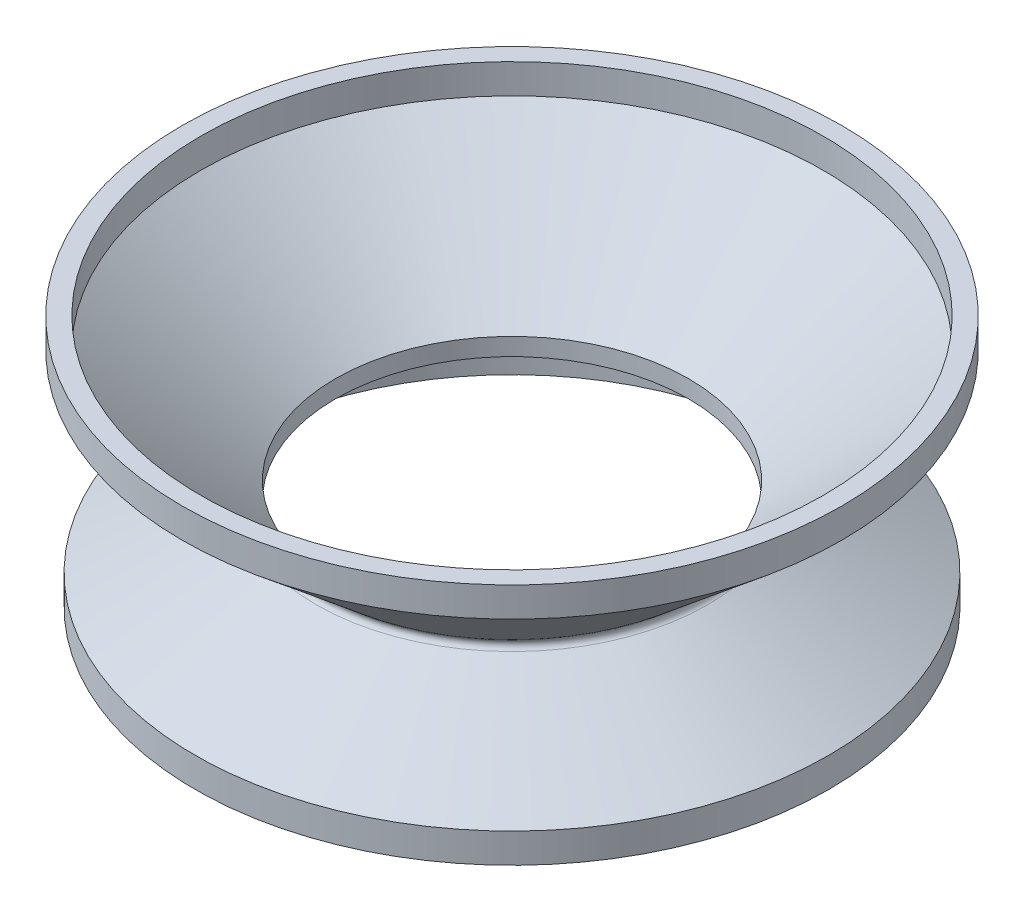
from build123d import *

# Parameters (mm, degrees)
FILLET2_R           = 0.4
SKETCH2_R           = 22.244579061
SKETCH2_R_2         = 21
BOSS_EXTRUDE1_DEPTH = 2
SKETCH3_R           = 21.370804359
SKETCH3_R_2         = 19.170804359
BOSS_EXTRUDE2_DEPTH = 2


with BuildPart() as part:
    # Sketch1 → Revolve1 (revolve)
    with BuildSketch(Plane.XY):
        Polygon((0.662781953, 0), (-8.871246788, 8), (-7.626667727, 8), (1.462781953, 0.373046127), (1.462781953, -0.808290377), (-5.797472085, -5), (-7.997472085, -5), align=None)
    revolve(axis=Axis((13.373332273, 7.609018033, 0), (0, -1, 0)))

    # Fillet2
    fillet2_edges = [part.edges().sort_by_distance(p)[0] for p in [
        (26.083882594, 0, 0),
    ]]
    fillet(fillet2_edges, radius=FILLET2_R)

    # Sketch2 → Boss-Extrude1 (add)
    with BuildSketch(Plane(origin=(0, 8, 0), x_dir=(1, 0, 0), z_dir=(0, 1, 0))):
        with Locations(Location((13.373332273, 0, 0), (0, 0, 180))):
            Circle(SKETCH2_R)
        with Locations(Location((13.373332273, 0, 0), (0, 0, 180))):
            Circle(SKETCH2_R_2, mode=Mode.SUBTRACT)
    extrude(amount=BOSS_EXTRUDE1_DEPTH)

    # Sketch3 → Boss-Extrude2 (add)
    with BuildSketch(Plane.XZ.offset(5)):
        with Locations((13.373332273, 0)):
            Circle(SKETCH3_R)
        with Locations(Location((13.373332273, 0, 0), (0, 0, 180))):
            Circle(SKETCH3_R_2, mode=Mode.SUBTRACT)
    extrude(amount=BOSS_EXTRUDE2_DEPTH)


solid = part.part
